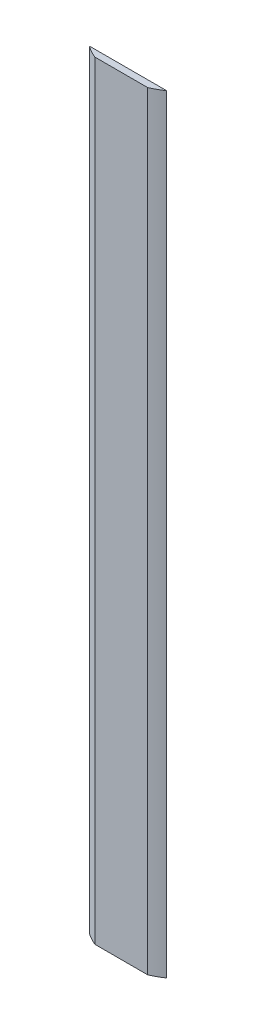
from build123d import *

# Parameters (mm, degrees)
BOSS_EXTRUDE1_DEPTH = 539.75


with BuildPart() as part:
    # Sketch1 → Boss-Extrude1 (new body)
    with BuildSketch(Plane(origin=(0, 0, 0), x_dir=(1, 0, 0), z_dir=(0, 1, 0))):
        with BuildLine():
            Line((-18.54394343, -43.935352443), (18.54394343, -43.935352443))
            ThreePointArc((18.54394343, -43.935352443), (22.994139444, -41.778733627), (27.197070866, -39.172852443))
            Line((27.197070866, -39.172852443), (-27.197070866, -39.172852443))
            ThreePointArc((-27.197070866, -39.172852443), (-22.994139444, -41.778733627), (-18.54394343, -43.935352443))
        make_face()
    extrude(amount=BOSS_EXTRUDE1_DEPTH)


solid = part.part
